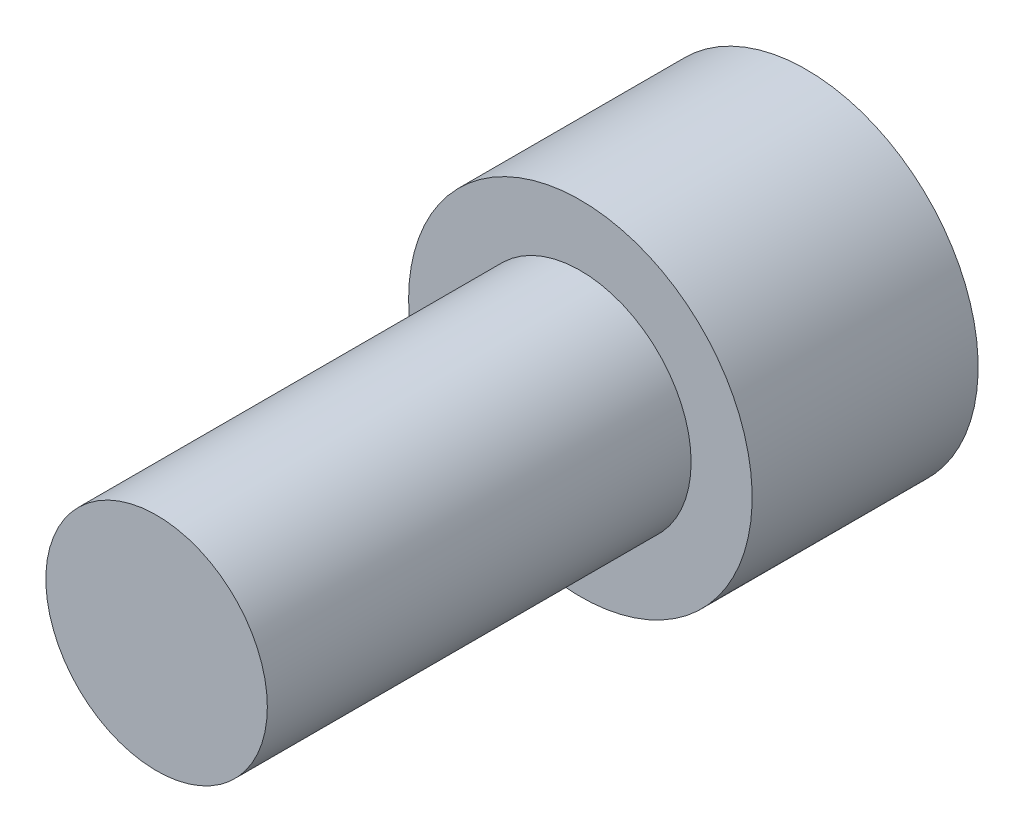
from build123d import *

# Parameters (mm, degrees)
SKETCH1_R         = 3.8608
EXTRUDE1_DEPTH    = 14.605
SKETCH2_OUTSIDE_W = 13.37
SKETCH2_OUTSIDE_H = 13.37
SKETCH2_OUTSIDE_R = 2.4892
EXTRUDE2_DEPTH    = 9.525
EXTRUDE3_DEPTH    = 3.048


with BuildPart() as part:
    # Sketch1 → Extrude1 (new body)
    with BuildSketch(Plane.XY):
        with Locations(Location((0, 0, 0), (0, 0, 180))):
            Circle(SKETCH1_R)
    extrude(amount=EXTRUDE1_DEPTH)

    # Sketch2 outside → Extrude2 (cut)
    with BuildSketch(Plane.XY.offset(14.605)):
        Rectangle(SKETCH2_OUTSIDE_W, SKETCH2_OUTSIDE_H)
        Circle(SKETCH2_OUTSIDE_R, mode=Mode.SUBTRACT)
    extrude(amount=-EXTRUDE2_DEPTH, mode=Mode.SUBTRACT)

    # Sketch3 → Extrude3 (cut)
    with BuildSketch(Plane(origin=(0, 0, 0), x_dir=(-1, 0, 0), z_dir=(0, 0, -1))):
        Polygon((0, 2.987683948), (-2.587410198, 1.493841974), (-2.587410198, -1.493841974), (0, -2.987683948), (2.587410198, -1.493841974), (2.587410198, 1.493841974), align=None)
    extrude(amount=-EXTRUDE3_DEPTH, mode=Mode.SUBTRACT)


solid = part.part
